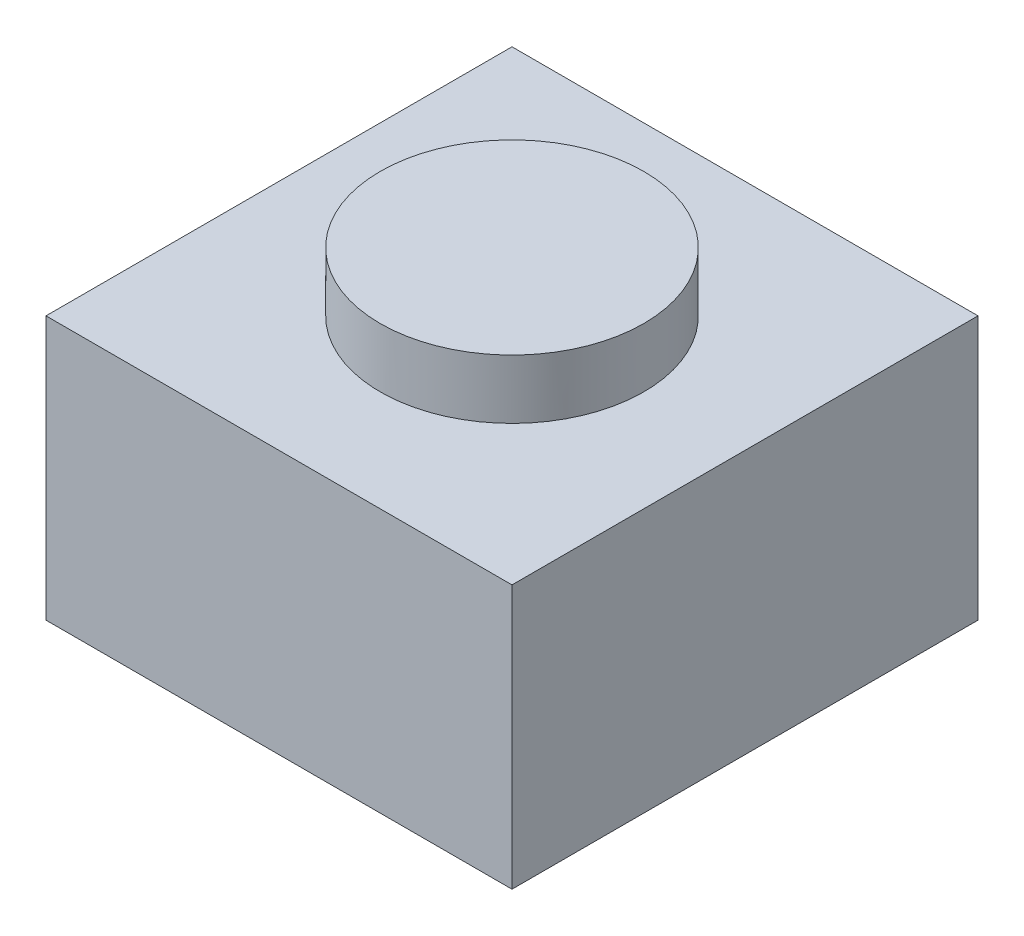
from build123d import *

# Parameters (mm, degrees)
SKETCH1_W           = 6.1976
SKETCH1_H           = 6.1976
BOSS_EXTRUDE1_DEPTH = 3.5052
SKETCH2_R           = 1.7526
BOSS_EXTRUDE2_DEPTH = 0.7874


with BuildPart() as part:
    # Sketch1 → Boss-Extrude1 (new body)
    with BuildSketch(Plane(origin=(0, 0, 0), x_dir=(1, 0, 0), z_dir=(0, 1, 0))):
        with Locations((3.0988, 3.0988)):
            Rectangle(SKETCH1_W, SKETCH1_H)
    extrude(amount=BOSS_EXTRUDE1_DEPTH)

    # Sketch2 → Boss-Extrude2 (add)
    with BuildSketch(Plane(origin=(0, 3.5052, 0), x_dir=(1, 0, 0), z_dir=(0, 1, 0))):
        with Locations(Location((3.0988, 3.0988, 0), (0, 0, 90))):
            Circle(SKETCH2_R)
    extrude(amount=BOSS_EXTRUDE2_DEPTH)


solid = part.part
